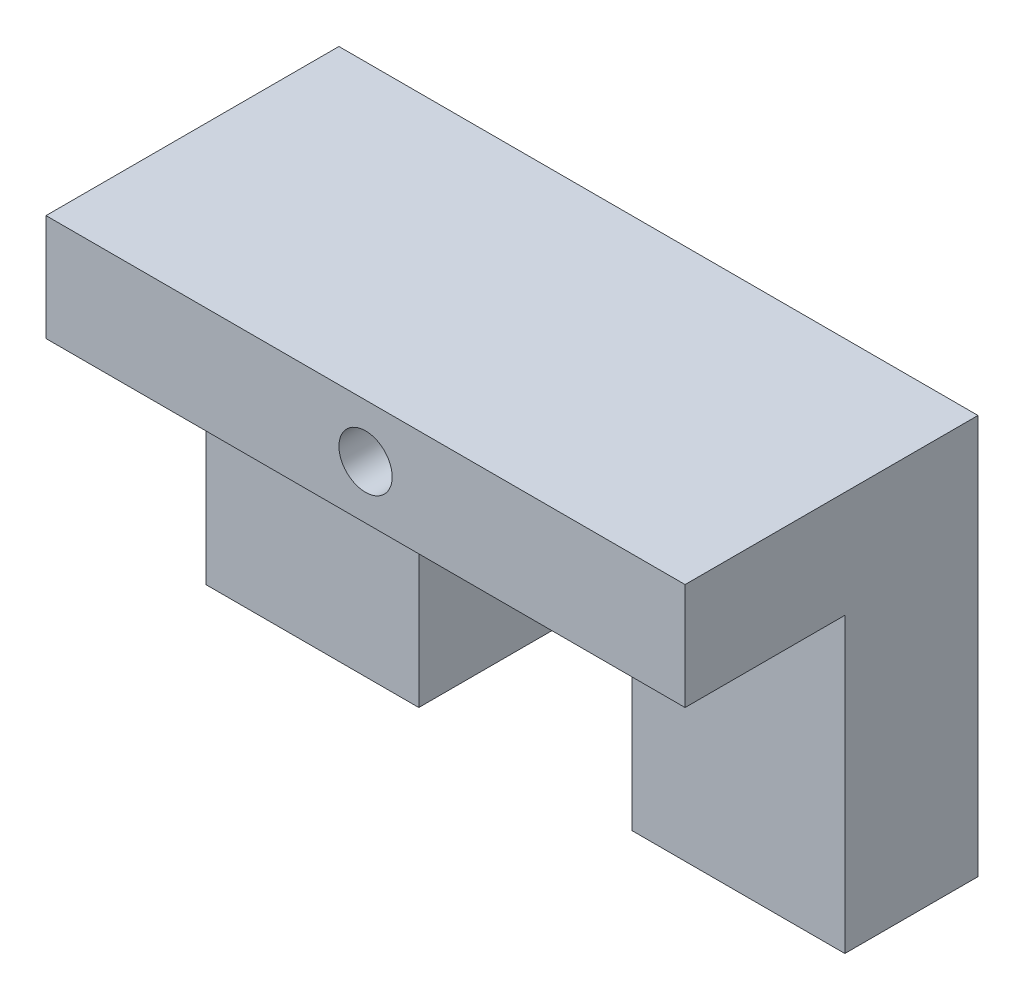
from build123d import *

# Parameters (mm, degrees)
SKETCH_1_W          = 120
SKETCH_1_H          = 75
EXTRUDE_1_DEPTH     = 25
SKETCH_2_W          = 40
SKETCH_2_H          = 25
CUT_EXTRUDE_1_DEPTH = 30
SKETCH_3_W          = 120
SKETCH_3_H          = 20
EXTRUDE_2_DEPTH     = 30
EXTRUDE_START       = -55
EXTRUDE_3_DEPTH     = 10
CUT_EXTRUDE_2_DEPTH = 152.822264507


with BuildPart() as part:
    # Эскиз1 → Бобышка-Вытянуть1 (new body)
    with BuildSketch(Plane.XY):
        with Locations((60, -37.5)):
            Rectangle(SKETCH_1_W, SKETCH_1_H)
    extrude(amount=EXTRUDE_1_DEPTH)

    # Эскиз2 → Вырез-Вытянуть1 (cut)
    with BuildSketch(Plane.XZ.offset(75)):
        with Locations((60, 12.5)):
            Rectangle(SKETCH_2_W, SKETCH_2_H)
    extrude(amount=-CUT_EXTRUDE_1_DEPTH, mode=Mode.SUBTRACT)

    # Эскиз3 → Бобышка-Вытянуть2 (add)
    with BuildSketch(Plane.XY.offset(25)):
        with Locations((60, -10)):
            Rectangle(SKETCH_3_W, SKETCH_3_H)
    extrude(amount=EXTRUDE_2_DEPTH)

    # Эскиз5 → Бобышка-Вытянуть3 (add)
    with BuildSketch(Plane(origin=(120, 0, 0), x_dir=(0, 0, -1), z_dir=(1, 0, 0)).offset(EXTRUDE_START)):
        Polygon((-55, -20), (-25, -45), (-25, -20), align=None)
    extrude(amount=-EXTRUDE_3_DEPTH)

    # Эскиз6 → Вырез-Вытянуть2 (cut, through all)
    with BuildSketch(Plane.XY.offset(55)):
        with BuildLine():
            ThreePointArc((55, -10), (56.464466094, -13.535533906), (60, -15))
            Line((60, -15), (60, -10))
            Line((60, -10), (55, -10))
        make_face()
        with BuildLine():
            Line((60, -10), (60, -15))
            ThreePointArc((60, -15), (63.535533906, -13.535533906), (65, -10))
            Line((65, -10), (60, -10))
        make_face()
        with BuildLine():
            Line((55, -10), (60, -10))
            Line((60, -10), (60, -5))
            ThreePointArc((60, -5), (56.464466094, -6.464466094), (55, -10))
        make_face()
        with BuildLine():
            Line((60, -5), (60, -10))
            Line((60, -10), (65, -10))
            ThreePointArc((65, -10), (63.535533906, -6.464466094), (60, -5))
        make_face()
    extrude(amount=-CUT_EXTRUDE_2_DEPTH, mode=Mode.SUBTRACT)


solid = part.part
